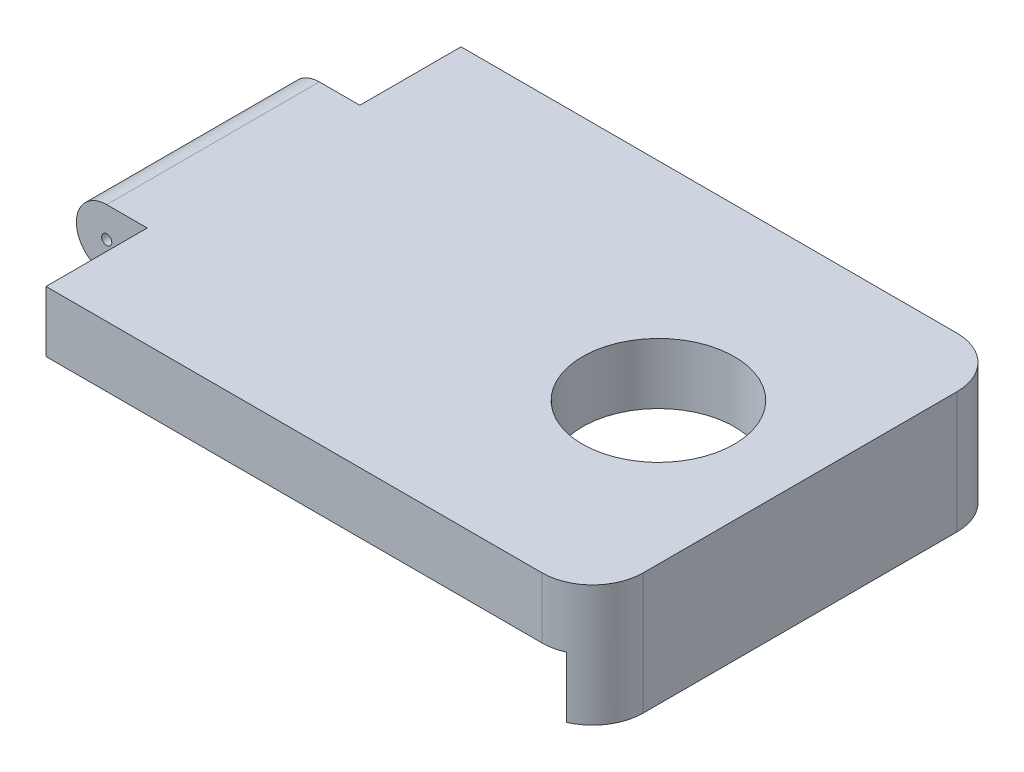
from build123d import *

# Parameters (mm, degrees)
EXTRUDE_1_DEPTH     = 6
FILLET_1_RADIUS     = 3
FILLET_1_LENGTH     = 21
SKETCH_2_R          = 7.5
CUT_EXTRUDE_1_DEPTH = 6
FILLET_2_R          = 5
FILLET_3_R          = 5
EXTRUDE_2_DEPTH     = 6
SKETCH_4_R          = 0.5
CUT_EXTRUDE_2_DEPTH = 21


with BuildPart() as part:
    # Эскиз1 → Бобышка-Вытянуть1 (new body)
    with BuildSketch(Plane(origin=(0, 0, 0), x_dir=(1, 0, 0), z_dir=(0, 1, 0))):
        Polygon((-27, -20.5), (27, -20.5), (27, 20.5), (-27, 20.5), (-27, 10.5), (-34, 10.5), (-34, -10.5), (-27, -10.5), align=None)
    extrude(amount=EXTRUDE_1_DEPTH)

    # Скругление1: full round fillet: the end face becomes a half cylinder, R = half its width
    fillet_1_face = Plane((-34, 3, 0), x_dir=(0, 0, -1), z_dir=(-1, 0, 0))  # on the end face: x along it, z out of the body
    fillet_1_slab = fillet_1_face.offset(-FILLET_1_RADIUS / 2) * Box(FILLET_1_LENGTH, 2 * FILLET_1_RADIUS, FILLET_1_RADIUS, mode=Mode.PRIVATE)  # the body's end, R deep
    fillet_1_round = Plane((-31, 3, 0), x_dir=(-1, 0, 0), z_dir=(0, 0, -1)) * Cylinder(FILLET_1_RADIUS, FILLET_1_LENGTH, mode=Mode.PRIVATE)  # its axis R under the face
    add(fillet_1_slab - fillet_1_round, mode=Mode.SUBTRACT)

    # Эскиз2 → Вырез-Вытянуть1 (cut)
    with BuildSketch(Plane(origin=(0, 6, 0), x_dir=(1, 0, 0), z_dir=(0, 1, 0))):
        with Locations(Location((13, 0, 0), (0, 0, 270))):
            Circle(SKETCH_2_R)
    extrude(amount=-CUT_EXTRUDE_1_DEPTH, mode=Mode.SUBTRACT)

    # Скругление2
    fillet_2_edges = [part.edges().sort_by_distance(p)[0] for p in [
        (27, 3, -20.5),
    ]]
    fillet(fillet_2_edges, radius=FILLET_2_R)

    # Скругление3
    fillet_3_edges = [part.edges().sort_by_distance(p)[0] for p in [
        (27, 3, 20.5),
    ]]
    fillet(fillet_3_edges, radius=FILLET_3_R)

    # Эскиз3 → Бобышка-Вытянуть2 (add)
    with BuildSketch(Plane.XZ):
        with BuildLine():
            Line((24, 15.5), (24, -20.082575695))
            ThreePointArc((24, -20.082575695), (26.183300133, -18.238612788), (27, -15.5))
            Line((27, -15.5), (27, 15.5))
            ThreePointArc((27, 15.5), (26.183300133, 18.238612788), (24, 20.082575695))
            Line((24, 20.082575695), (24, 15.5))
        make_face()
    extrude(amount=EXTRUDE_2_DEPTH)

    # Эскиз4 → Вырез-Вытянуть2 (cut)
    with BuildSketch(Plane.XY.offset(10.5)):
        with Locations((-31, 3)):
            Circle(SKETCH_4_R)
    extrude(amount=-CUT_EXTRUDE_2_DEPTH, mode=Mode.SUBTRACT)


solid = part.part
